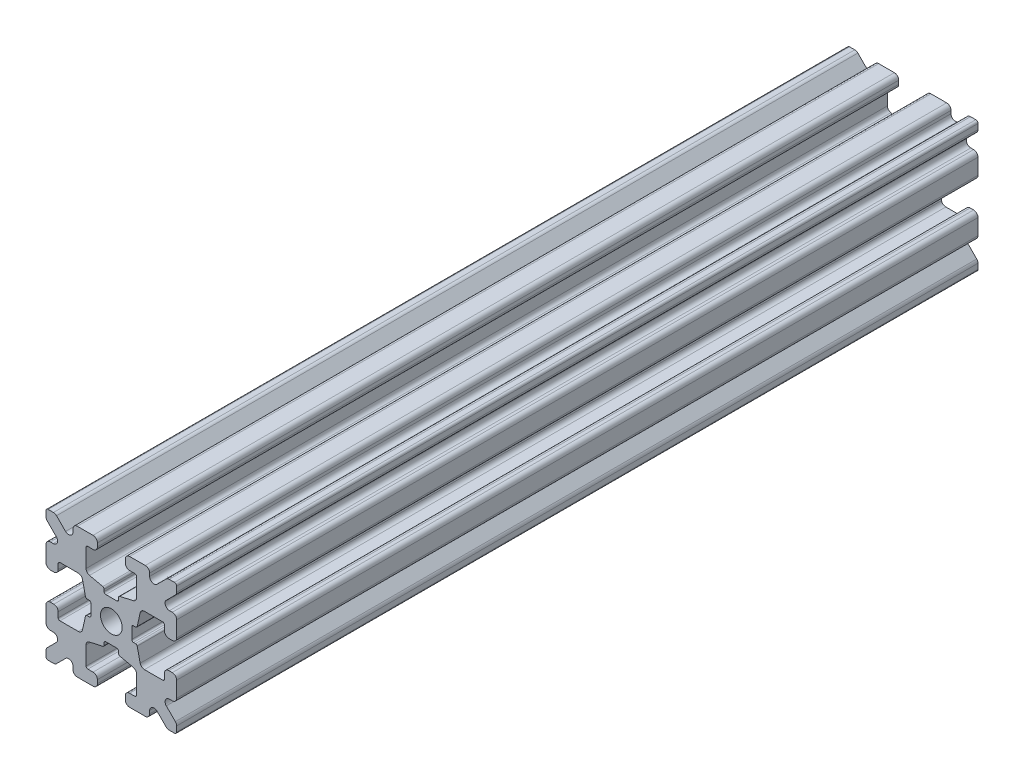
from build123d import *

# Parameters (mm, degrees)
SKETCH1_W           = 15
SKETCH1_H           = 15
SKETCH1_R           = 1.25
BOSS_EXTRUDE1_DEPTH = 46
FILLET1_R           = 0.25
CUT_EXTRUDE1_DEPTH  = 93.609394772
CUT_EXTRUDE3_DEPTH  = 93.609394772
FILLET3_R           = 0.5
FILLET4_R           = 0.5
FILLET5_R           = 3
FILLET6_R           = 0.2
CUT_EXTRUDE4_DEPTH  = 93.609394772
FILLET8_R           = 0.5
SKETCH6_W           = 5.1529354
SKETCH6_H           = 1.651
SKETCH6_W_2         = 1.651
SKETCH6_H_2         = 5.1529354
CUT_EXTRUDE5_DEPTH  = 93.609394772
FILLET10_R          = 0.2


with BuildPart() as part:
    # Sketch1 → Boss-Extrude1 (new, symmetric)
    with BuildSketch(Plane.XY):
        Rectangle(SKETCH1_W, SKETCH1_H)
        Circle(SKETCH1_R, mode=Mode.SUBTRACT)
    extrude(amount=BOSS_EXTRUDE1_DEPTH, both=True)

    # Fillet1
    fillet1_edges = [part.edges().sort_by_distance(p)[0] for p in [
        (7.5, -7.5, 0),
        (-7.5, -7.5, 0),
        (-7.5, 7.5, 0),
        (7.5, 7.5, 0),
    ]]
    fillet(fillet1_edges, radius=FILLET1_R)

    # Sketch2 → Cut-Extrude1 (cut, through all)
    with BuildSketch(Plane.XY.offset(46)):
        Polygon((-7.5, 1.6), (-6.1, 1.6), (-6.1, 2.9), (-3.4, 2.9), (-3.4, -2.9), (-6.1, -2.9), (-6.1, -1.6), (-7.5, -1.6), align=None)
        Polygon((2.9, 6.1), (1.6, 6.1), (1.6, 7.5), (-1.6, 7.5), (-1.6, 6.1), (-2.9, 6.1), (-2.9, 3.4), (2.9, 3.4), align=None)
        Polygon((-1.6, -7.5), (-1.6, -6.1), (-2.9, -6.1), (-2.9, -3.4), (2.9, -3.4), (2.9, -6.1), (1.6, -6.1), (1.6, -7.5), align=None)
        Polygon((6.1, -2.9), (6.1, -1.6), (7.5, -1.6), (7.5, 1.6), (6.1, 1.6), (6.1, 2.9), (3.4, 2.9), (3.4, -2.9), align=None)
    extrude(amount=-CUT_EXTRUDE1_DEPTH, mode=Mode.SUBTRACT)

    # Sketch4 → Cut-Extrude3 (cut, through all)
    with BuildSketch(Plane.XY.offset(46)):
        Polygon((-3.4, 2.9), (-2.75, 0), (-3.4, -2.9), align=None)
        Polygon((-2.9, 3.4), (0, 2.75), (2.9, 3.4), align=None)
        Polygon((3.4, 2.9), (2.75, 0), (3.4, -2.9), align=None)
        Polygon((-2.9, -3.4), (0, -2.75), (2.9, -3.4), align=None)
    extrude(amount=-CUT_EXTRUDE3_DEPTH, mode=Mode.SUBTRACT)

    # Fillet3
    fillet3_edges = [part.edges().sort_by_distance(p)[0] for p in [
        (1.6, -7.5, 0),
        (-1.6, -7.5, 0),
        (-1.6, -6.1, 0),
        (1.6, -6.1, 0),
        (6.1, 1.6, 0),
        (7.5, 1.6, 0),
        (7.5, -1.6, 0),
        (6.1, -1.6, 0),
        (-7.5, -1.6, 0),
        (-7.5, 1.6, 0),
        (-6.1, 1.6, 0),
        (-6.1, -1.6, 0),
        (-1.6, 6.1, 0),
        (-1.6, 7.5, 0),
        (1.6, 7.5, 0),
        (1.6, 6.1, 0),
    ]]
    fillet(fillet3_edges, radius=FILLET3_R)

    # Fillet4
    fillet4_edges = [part.edges().sort_by_distance(p)[0] for p in [
        (-2.9, -3.4, 0),
        (2.9, -3.4, 0),
        (3.4, -2.9, 0),
        (3.4, 2.9, 0),
        (-3.4, 2.9, 0),
        (-3.4, -2.9, 0),
        (2.9, 3.4, 0),
        (-2.9, 3.4, 0),
    ]]
    fillet(fillet4_edges, radius=FILLET4_R)

    # Fillet5
    fillet5_edges = [part.edges().sort_by_distance(p)[0] for p in [
        (-2.75, 0, 0),
        (0, 2.75, 0),
        (2.75, 0, 0),
        (0, -2.75, 0),
    ]]
    fillet(fillet5_edges, radius=FILLET5_R)

    # Fillet6
    fillet6_edges = [part.edges().sort_by_distance(p)[0] for p in [
        (-2.9, -6.1, 0),
        (2.9, -6.1, 0),
        (6.1, -2.9, 0),
        (6.1, 2.9, 0),
        (-6.1, 2.9, 0),
        (-6.1, -2.9, 0),
        (2.9, 6.1, 0),
        (-2.9, 6.1, 0),
    ]]
    fillet(fillet6_edges, radius=FILLET6_R)

    # Sketch5 → Cut-Extrude4 (cut, through all)
    with BuildSketch(Plane.XY.offset(46)):
        Polygon((-7.5, 6.439339828), (-5.460660172, 4.4), (-7.5, 4.4), align=None)
        Polygon((-6.439339828, 7.5), (-4.4, 5.460660172), (-4.4, 7.5), align=None)
        Polygon((4.4, 7.5), (6.439339828, 7.5), (4.4, 5.460660172), align=None)
        Polygon((7.5, 6.439339828), (7.5, 4.4), (5.460660172, 4.4), align=None)
        Polygon((7.5, -6.439339828), (5.460660172, -4.4), (7.5, -4.4), align=None)
        Polygon((6.439339828, -7.5), (4.4, -5.460660172), (4.4, -7.5), align=None)
        Polygon((-4.4, -7.5), (-6.439339828, -7.5), (-4.4, -5.460660172), align=None)
        Polygon((-7.5, -6.439339828), (-7.5, -4.4), (-5.460660172, -4.4), align=None)
    extrude(amount=-CUT_EXTRUDE4_DEPTH, mode=Mode.SUBTRACT)

    # Fillet8
    fillet8_edges = [part.edges().sort_by_distance(p)[0] for p in [
        (-7.5, 4.4, 0),
        (-7.5, 6.439339828, 0),
        (-5.460660172, 4.4, 0),
        (7.5, -4.4, 0),
        (7.5, -6.439339828, 0),
        (5.460660172, -4.4, 0),
        (5.460660172, 4.4, 0),
        (7.5, 6.439339828, 0),
        (7.5, 4.4, 0),
        (-4.4, 7.5, 0),
        (-4.4, 5.460660172, 0),
        (-6.439339828, 7.5, 0),
        (-5.460660172, -4.4, 0),
        (-7.5, -6.439339828, 0),
        (-7.5, -4.4, 0),
        (4.4, 5.460660172, 0),
        (4.4, 7.5, 0),
        (6.439339828, 7.5, 0),
        (6.439339828, -7.5, 0),
        (4.4, -7.5, 0),
        (4.4, -5.460660172, 0),
        (-6.439339828, -7.5, 0),
        (-4.4, -5.460660172, 0),
        (-4.4, -7.5, 0),
    ]]
    fillet(fillet8_edges, radius=FILLET8_R)

    # Sketch6 → Cut-Extrude5 (cut, through all)
    with BuildSketch(Plane.XY.offset(46)):
        with Locations((4.9235323, 0)):
            Rectangle(SKETCH6_W, SKETCH6_H)
        with Locations((0, -4.9235323)):
            Rectangle(SKETCH6_W_2, SKETCH6_H_2)
        with Locations((-4.9235323, 0)):
            Rectangle(SKETCH6_W, SKETCH6_H)
        with Locations((0, 4.9235323)):
            Rectangle(SKETCH6_W_2, SKETCH6_H_2)
    extrude(amount=-CUT_EXTRUDE5_DEPTH, mode=Mode.SUBTRACT)

    # Fillet10
    fillet10_edges = [part.edges().sort_by_distance(p)[0] for p in [
        (0.8255, -2.935025862, 0),
        (-0.8255, -2.935025862, 0),
        (0.8255, -2.3470646, 0),
        (-0.8255, -2.3470646, 0),
        (2.935025862, 0.8255, 0),
        (2.935025862, -0.8255, 0),
        (2.3470646, 0.8255, 0),
        (2.3470646, -0.8255, 0),
        (-2.935025862, -0.8255, 0),
        (-2.935025862, 0.8255, 0),
        (-2.3470646, -0.8255, 0),
        (-2.3470646, 0.8255, 0),
        (-0.8255, 2.935025862, 0),
        (0.8255, 2.935025862, 0),
        (-0.8255, 2.3470646, 0),
        (0.8255, 2.3470646, 0),
    ]]
    fillet(fillet10_edges, radius=FILLET10_R)


solid = part.part
